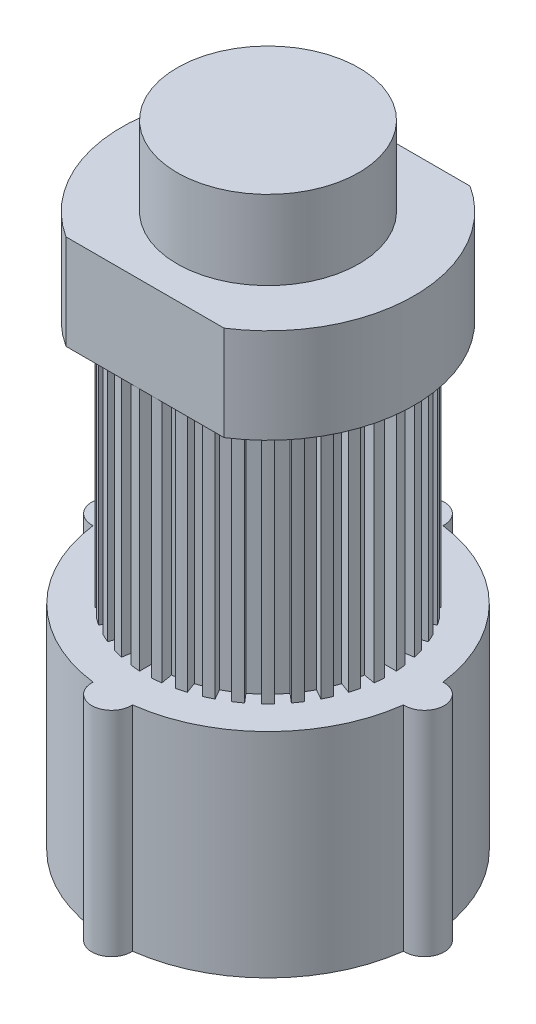
from build123d import *

# Parameters (mm, degrees)
SKETCH_1_R               = 8.2
EXTRUDE_1_DEPTH          = 1
SKETCH_2_R               = 2.5
SKETCH_2_R_2             = 19.798989873
SKETCH_2_R_3             = 8.2
EXTRUDE_2_DEPTH          = 27
SKETCH_3_R               = 15.5
EXTRUDE_4_DEPTH          = 43
SKETCH_4_R               = 11.5
EXTRUDE_5_DEPTH          = 10
EXTRUDE_6_DEPTH          = 12
CUT_EXTRUDE_1_DEPTH      = 31
PATTERN_CIRCULAR_1_COUNT = 36
SKETCH_7_R               = 2.5
EXTRUDE_7_DEPTH          = 10
CUT_EXTRUDE_START        = -5
CUT_EXTRUDE_2_DEPTH      = 5
SKETCH_10_R              = 1.5
CUT_EXTRUDE_3_DEPTH      = 15


with BuildPart() as part:
    # 草图1 → 凸台-拉伸1 (new body)
    with BuildSketch(Plane(origin=(0, 0, 0), x_dir=(1, 0, 0), z_dir=(0, 1, 0))):
        with Locations(Location((0, 0, 0), (0, 0, 270))):
            Circle(SKETCH_1_R)
    extrude(amount=EXTRUDE_1_DEPTH)

    # 草图2 → 凸台-拉伸2 (add)
    # profile 1 of 22: a face of its own
    with BuildSketch(Plane(origin=(0, 1, 0), x_dir=(1, 0, 0), z_dir=(0, 1, 0))):
        with Locations((-19.798989873, 0)):
            Circle(SKETCH_2_R)
    # profile 2 of 22: a face of its own
    with BuildSketch(Plane(origin=(0, 1, 0), x_dir=(1, 0, 0), z_dir=(0, 1, 0))):
        Circle(SKETCH_2_R_2)
        with Locations(Location((0, 0, 0), (0, 0, 270))):
            Circle(SKETCH_2_R_3, mode=Mode.SUBTRACT)
    # profile 3 of 22: a face of its own
    with BuildSketch(Plane(origin=(0, 1, 0), x_dir=(1, 0, 0), z_dir=(0, 1, 0))):
        with Locations((0, -19.798989873)):
            Circle(SKETCH_2_R)
    # profile 4 of 22: a face of its own
    with BuildSketch(Plane(origin=(0, 1, 0), x_dir=(1, 0, 0), z_dir=(0, 1, 0))):
        with Locations((19.798989873, 0)):
            Circle(SKETCH_2_R)
    # profile 5 of 22: a face of its own
    with BuildSketch(Plane(origin=(0, 1, 0), x_dir=(1, 0, 0), z_dir=(0, 1, 0))):
        with Locations((0, 19.798989873)):
            Circle(SKETCH_2_R)
    # profile 6 of 22: a face of its own
    with BuildSketch(Plane(origin=(0, 1, 0), x_dir=(1, 0, 0), z_dir=(0, 1, 0))):
        with Locations(Location((0, 0, 0), (0, 0, 270))):
            Circle(SKETCH_2_R_3)
    # profile 7 of 22: a face of its own
    with BuildSketch(Plane(origin=(0, 1, 0), x_dir=(1, 0, 0), z_dir=(0, 1, 0))):
        Circle(SKETCH_2_R_2)
    # profile 8 of 22: a face of its own
    with BuildSketch(Plane(origin=(0, 1, 0), x_dir=(1, 0, 0), z_dir=(0, 1, 0))):
        with Locations((19.798989873, 0)):
            Circle(SKETCH_2_R)
    # profile 9 of 22: a face of its own
    with BuildSketch(Plane(origin=(0, 1, 0), x_dir=(1, 0, 0), z_dir=(0, 1, 0))):
        Circle(SKETCH_2_R_2)
    # profile 10 of 22: a face of its own
    with BuildSketch(Plane(origin=(0, 1, 0), x_dir=(1, 0, 0), z_dir=(0, 1, 0))):
        with Locations((19.798989873, 0)):
            Circle(SKETCH_2_R)
    # profile 11 of 22: a face of its own
    with BuildSketch(Plane(origin=(0, 1, 0), x_dir=(1, 0, 0), z_dir=(0, 1, 0))):
        Circle(SKETCH_2_R_2)
    # profile 12 of 22: a face of its own
    with BuildSketch(Plane(origin=(0, 1, 0), x_dir=(1, 0, 0), z_dir=(0, 1, 0))):
        with Locations((0, 19.798989873)):
            Circle(SKETCH_2_R)
    # profile 13 of 22: a face of its own
    with BuildSketch(Plane(origin=(0, 1, 0), x_dir=(1, 0, 0), z_dir=(0, 1, 0))):
        Circle(SKETCH_2_R_2)
    # profile 14 of 22: a face of its own
    with BuildSketch(Plane(origin=(0, 1, 0), x_dir=(1, 0, 0), z_dir=(0, 1, 0))):
        with Locations((0, 19.798989873)):
            Circle(SKETCH_2_R)
    # profile 15 of 22: a face of its own
    with BuildSketch(Plane(origin=(0, 1, 0), x_dir=(1, 0, 0), z_dir=(0, 1, 0))):
        Circle(SKETCH_2_R_2)
    # profile 16 of 22: a face of its own
    with BuildSketch(Plane(origin=(0, 1, 0), x_dir=(1, 0, 0), z_dir=(0, 1, 0))):
        with Locations((-19.798989873, 0)):
            Circle(SKETCH_2_R)
    # profile 17 of 22: a face of its own
    with BuildSketch(Plane(origin=(0, 1, 0), x_dir=(1, 0, 0), z_dir=(0, 1, 0))):
        Circle(SKETCH_2_R_2)
    # profile 18 of 22: a face of its own
    with BuildSketch(Plane(origin=(0, 1, 0), x_dir=(1, 0, 0), z_dir=(0, 1, 0))):
        with Locations((-19.798989873, 0)):
            Circle(SKETCH_2_R)
    # profile 19 of 22: a face of its own
    with BuildSketch(Plane(origin=(0, 1, 0), x_dir=(1, 0, 0), z_dir=(0, 1, 0))):
        Circle(SKETCH_2_R_2)
    # profile 20 of 22: a face of its own
    with BuildSketch(Plane(origin=(0, 1, 0), x_dir=(1, 0, 0), z_dir=(0, 1, 0))):
        with Locations((0, -19.798989873)):
            Circle(SKETCH_2_R)
    # profile 21 of 22: a face of its own
    with BuildSketch(Plane(origin=(0, 1, 0), x_dir=(1, 0, 0), z_dir=(0, 1, 0))):
        Circle(SKETCH_2_R_2)
    # profile 22 of 22: a face of its own
    with BuildSketch(Plane(origin=(0, 1, 0), x_dir=(1, 0, 0), z_dir=(0, 1, 0))):
        with Locations((0, -19.798989873)):
            Circle(SKETCH_2_R)
    extrude(amount=EXTRUDE_2_DEPTH)

    # 草图3 → 凸台-拉伸4 (add)
    with BuildSketch(Plane(origin=(0, 28, 0), x_dir=(1, 0, 0), z_dir=(0, 1, 0))):
        with Locations(Location((0, 0, 0), (0, 0, 90))):
            Circle(SKETCH_3_R)
    extrude(amount=EXTRUDE_4_DEPTH)

    # 草图4 → 凸台-拉伸5 (add)
    with BuildSketch(Plane(origin=(0, 71, 0), x_dir=(1, 0, 0), z_dir=(0, 1, 0))):
        with Locations(Location((0, 0, 0), (0, 0, 270))):
            Circle(SKETCH_4_R)
    extrude(amount=EXTRUDE_5_DEPTH)

    # 草图5 → 凸台-拉伸6 (add)
    with BuildSketch(Plane(origin=(0, 71, 0), x_dir=(1, 0, 0), z_dir=(0, 1, 0))):
        with BuildLine():
            Line((-10, 15.564382416), (10, 15.564382416))
            ThreePointArc((10, 15.564382416), (18.5, 0), (10, -15.564382416))
            Line((10, -15.564382416), (-10, -15.564382416))
            ThreePointArc((-10, -15.564382416), (-18.5, 0), (-10, 15.564382416))
        make_face()
    extrude(amount=-EXTRUDE_6_DEPTH)

    # 草图6 → 切除-拉伸1 (cut)
    with BuildSketch(Plane(origin=(0, 28, 0), x_dir=(1, 0, 0), z_dir=(0, 1, 0))):
        with BuildLine():
            ThreePointArc((-15.481844205, 0.75), (-15.5, 0), (-15.481844205, -0.75))
            Line((-15.481844205, -0.75), (-14, -0.75))
            Line((-14, -0.75), (-14, 0.75))
            Line((-14, 0.75), (-15.481844205, 0.75))
        make_face()
    cut_extrude_1 = extrude(amount=CUT_EXTRUDE_1_DEPTH, mode=Mode.SUBTRACT)

    # 阵列(圆周)1: 切除-拉伸1 ×36 about axis
    pattern_circular_1_axis = Axis((0, 0, 0), (0, 1, 0))
    for i in range(1, PATTERN_CIRCULAR_1_COUNT):
        add(cut_extrude_1.rotate(pattern_circular_1_axis, i * 360 / PATTERN_CIRCULAR_1_COUNT), mode=Mode.SUBTRACT)

    # 草图7 → 凸台-拉伸7 (add)
    with BuildSketch(Plane.XZ):
        with Locations(Location((0, 0, 0), (0, 0, 270))):
            Circle(SKETCH_7_R)
    extrude(amount=EXTRUDE_7_DEPTH)

    # 草图9 → 切除-拉伸2 (cut)
    with BuildSketch(Plane(origin=(0, -9, 0), x_dir=(-1, 0, 0), z_dir=(0, -1, 0)).offset(CUT_EXTRUDE_START)):
        with BuildLine():
            ThreePointArc((-2.5, 0), (-1.767766953, -1.767766953), (0, -2.5))
            Line((0, -2.5), (-2.5, 0))
        make_face()
        with BuildLine():
            ThreePointArc((0, -2.5), (1.767766953, -1.767766953), (2.5, 0))
            Line((2.5, 0), (0, -2.5))
        make_face()
    extrude(amount=CUT_EXTRUDE_2_DEPTH, mode=Mode.SUBTRACT)

    # 草图10 → 切除-拉伸3 (cut)
    with BuildSketch(Plane.XZ.offset(-1)):
        with Locations(Location((-10.159464787, -10.159464787, 0), (0, 0, 270))):
            Circle(SKETCH_10_R)
        with Locations(Location((-3.718622201, 13.878086988, 0), (0, 0, 270))):
            Circle(SKETCH_10_R)
        with Locations(Location((13.878086988, -3.718622201, 0), (0, 0, 270))):
            Circle(SKETCH_10_R)
    extrude(amount=-CUT_EXTRUDE_3_DEPTH, mode=Mode.SUBTRACT)


solid = part.part
